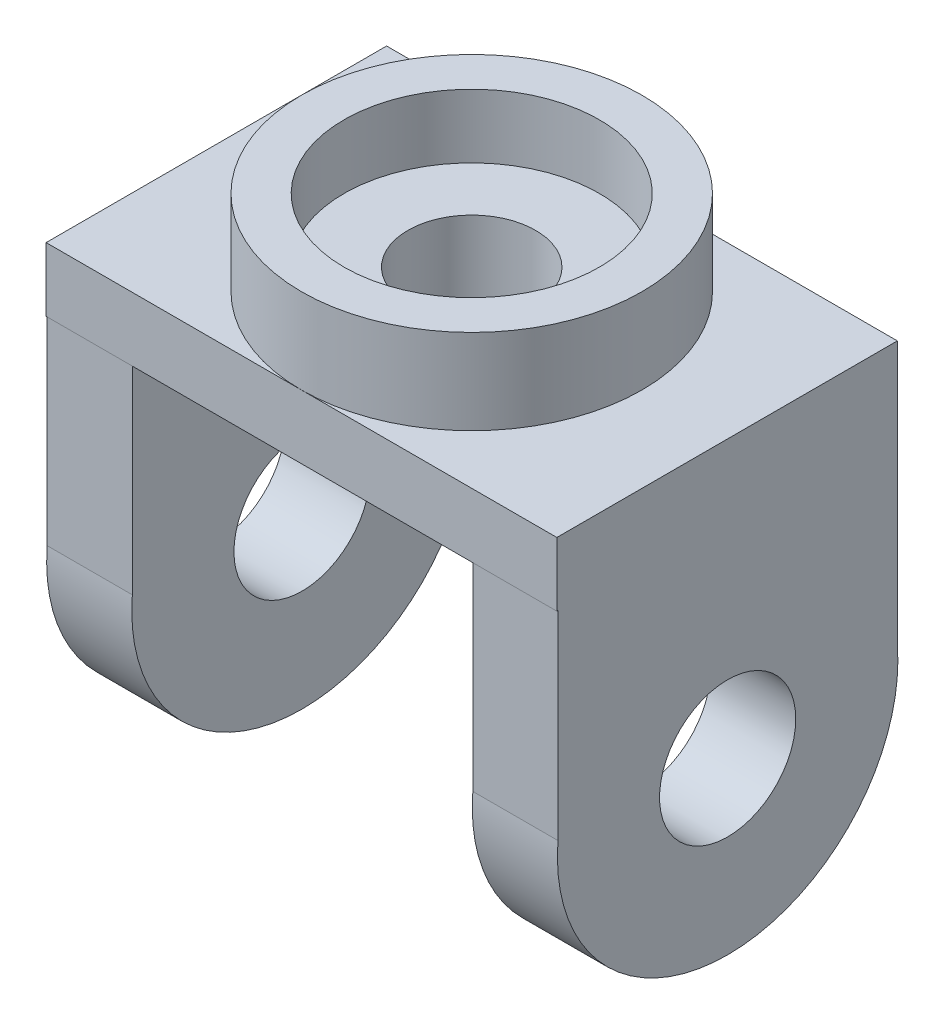
from build123d import *

# Parameters (mm, degrees)
SKETCH1_W           = 120
SKETCH1_H           = 80
BOSS_EXTRUDE1_DEPTH = 15
SKETCH2_R           = 40
BOSS_EXTRUDE2_DEPTH = 20
SKETCH3_R           = 30
CUT_EXTRUDE1_DEPTH  = 15
SKETCH4_R           = 15
CUT_EXTRUDE2_DEPTH  = 75.833147735
BOSS_EXTRUDE3_DEPTH = 20
SKETCH6_R           = 16
CUT_EXTRUDE3_DEPTH  = 156.274782914


with BuildPart() as part:
    # Sketch1 → Boss-Extrude1 (new body)
    with BuildSketch(Plane(origin=(0, 0, 0), x_dir=(1, 0, 0), z_dir=(0, 1, 0))):
        Rectangle(SKETCH1_W, SKETCH1_H)
    extrude(amount=BOSS_EXTRUDE1_DEPTH)

    # Sketch2 → Boss-Extrude2 (add)
    with BuildSketch(Plane(origin=(0, 15, 0), x_dir=(1, 0, 0), z_dir=(0, 1, 0))):
        with Locations(Location((0, 0, 0), (0, 0, 270))):
            Circle(SKETCH2_R)
    extrude(amount=BOSS_EXTRUDE2_DEPTH)

    # Sketch3 → Cut-Extrude1 (cut)
    with BuildSketch(Plane(origin=(0, 35, 0), x_dir=(1, 0, 0), z_dir=(0, 1, 0))):
        with Locations(Location((0, 0, 0), (0, 0, 270))):
            Circle(SKETCH3_R)
    extrude(amount=-CUT_EXTRUDE1_DEPTH, mode=Mode.SUBTRACT)

    # Sketch4 → Cut-Extrude2 (cut, through all)
    with BuildSketch(Plane(origin=(0, 20, 0), x_dir=(1, 0, 0), z_dir=(0, 1, 0))):
        with Locations(Location((0, 0, 0), (0, 0, 270))):
            Circle(SKETCH4_R)
    extrude(amount=-CUT_EXTRUDE2_DEPTH, mode=Mode.SUBTRACT)

    # Sketch5 → Boss-Extrude3 (add)
    with BuildSketch(Plane(origin=(60, 0, 0), x_dir=(0, 0, -1), z_dir=(1, 0, 0))):
        with BuildLine():
            Line((40, -46.802277462), (40, 0))
            Line((40, 0), (-39.743954519, 0))
            Line((-39.743954519, 0), (-39.743954519, -46.802277462))
            ThreePointArc((-39.743954519, -46.802277462), (0.128022741, -10), (40, -46.802277462))
        make_face()
        with BuildLine():
            ThreePointArc((40.128022741, -50), (40.096004241, -48.399857877), (40, -46.802277462))
            Line((40, -46.802277462), (40, -50))
            Line((40, -50), (-39.743954519, -50))
            Line((-39.743954519, -50), (-39.743954519, -46.802277462))
            ThreePointArc((-39.743954519, -46.802277462), (-1.472119382, -89.9679815), (40.128022741, -50))
        make_face()
        with BuildLine():
            Line((40, -50), (40, -46.802277462))
            ThreePointArc((40, -46.802277462), (0.128022741, -10), (-39.743954519, -46.802277462))
            Line((-39.743954519, -46.802277462), (-39.743954519, -50))
            Line((-39.743954519, -50), (40, -50))
        make_face()
    boss_extrude3 = extrude(amount=-BOSS_EXTRUDE3_DEPTH)

    # Sketch6 → Cut-Extrude3 (cut, through all)
    with BuildSketch(Plane(origin=(60, 0, 0), x_dir=(0, 0, -1), z_dir=(1, 0, 0))):
        with Locations((0.128022741, -50)):
            Circle(SKETCH6_R)
    cut_extrude3 = extrude(amount=-CUT_EXTRUDE3_DEPTH, mode=Mode.SUBTRACT)

    # Mirror2: Boss-Extrude3, Cut-Extrude3 across plane
    add(boss_extrude3.mirror(Plane(origin=(0, 0, 0), x_dir=(0, 0, 1), z_dir=(1, 0, 0))))
    add(cut_extrude3.mirror(Plane(origin=(0, 0, 0), x_dir=(0, 0, 1), z_dir=(1, 0, 0))), mode=Mode.SUBTRACT)


solid = part.part
